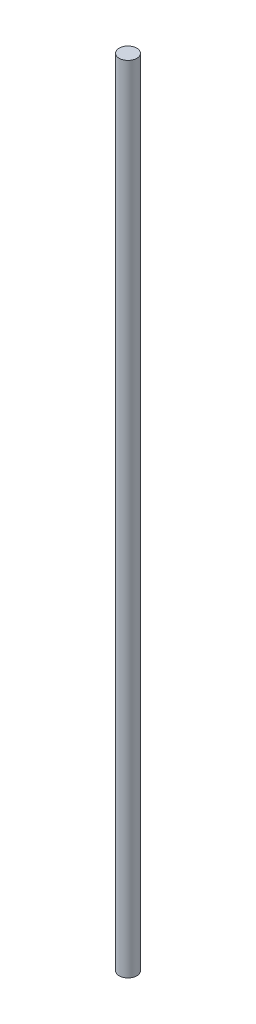
from build123d import *

# Parameters (mm, degrees)
SKETCH1_R           = 5
BOSS_EXTRUDE2_DEPTH = 450


with BuildPart() as part:
    # Sketch1 → Boss-Extrude2 (new body)
    with BuildSketch(Plane(origin=(0, 0, 0), x_dir=(1, 0, 0), z_dir=(0, 1, 0))):
        with Locations(Location((0, 0, 0), (0, 0, 270))):
            Circle(SKETCH1_R)
    extrude(amount=BOSS_EXTRUDE2_DEPTH)


solid = part.part
